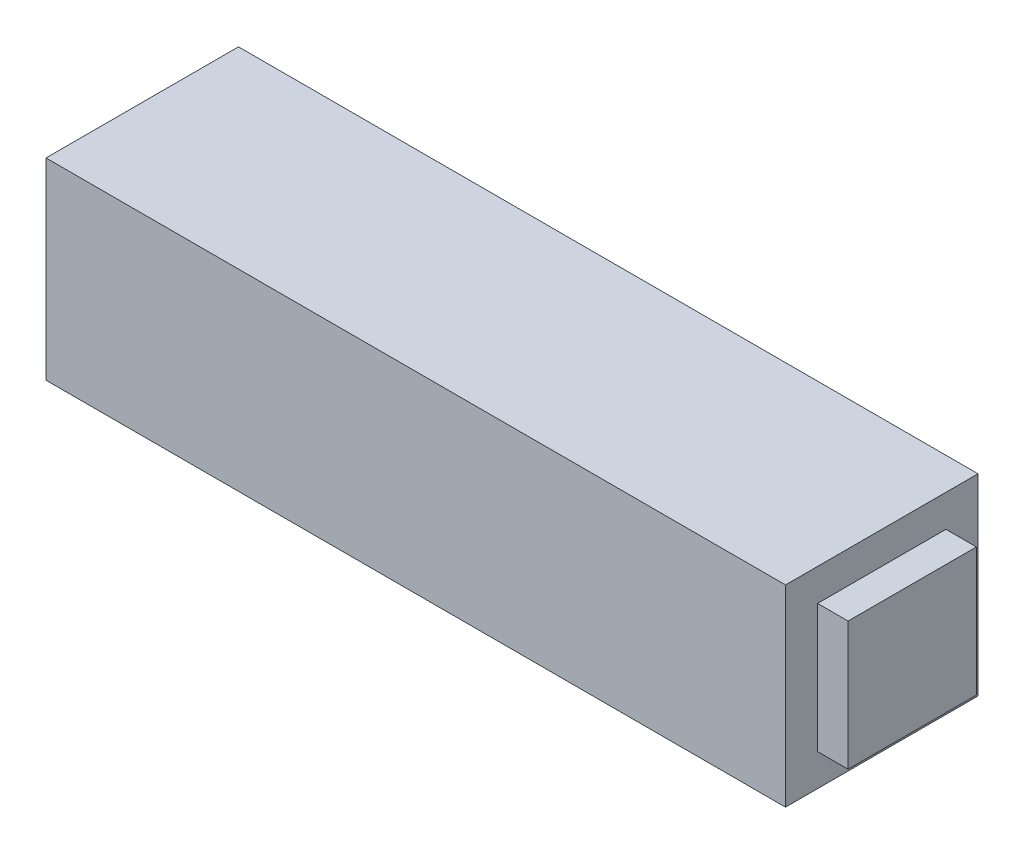
from build123d import *

# Parameters (mm, degrees)
SKETCH1_W           = 115.25
SKETCH1_H           = 30
BOSS_EXTRUDE1_DEPTH = 15
SKETCH2_W           = 20.5
SKETCH2_H           = 20.5
CUT_EXTRUDE2_DEPTH  = 10
SKETCH3_W           = 20
SKETCH3_H           = 20
BOSS_EXTRUDE2_DEPTH = 4.75


with BuildPart() as part:
    # Sketch1 → Boss-Extrude1 (new, symmetric)
    with BuildSketch(Plane.XY):
        with Locations((0, -3.077586207)):
            Rectangle(SKETCH1_W, SKETCH1_H)
    extrude(amount=BOSS_EXTRUDE1_DEPTH, both=True)

    # Sketch2 → Cut-Extrude2 (cut)
    with BuildSketch(Plane.ZY.offset(57.625)):
        with Locations((0, -3.327586207)):
            Rectangle(SKETCH2_W, SKETCH2_H)
    extrude(amount=-CUT_EXTRUDE2_DEPTH, mode=Mode.SUBTRACT)

    # Sketch3 → Boss-Extrude2 (add)
    with BuildSketch(Plane(origin=(57.625, 0, 0), x_dir=(0, 0, -1), z_dir=(1, 0, 0))):
        with Locations((0, -3.077586207)):
            Rectangle(SKETCH3_W, SKETCH3_H)
    extrude(amount=BOSS_EXTRUDE2_DEPTH)


solid = part.part
